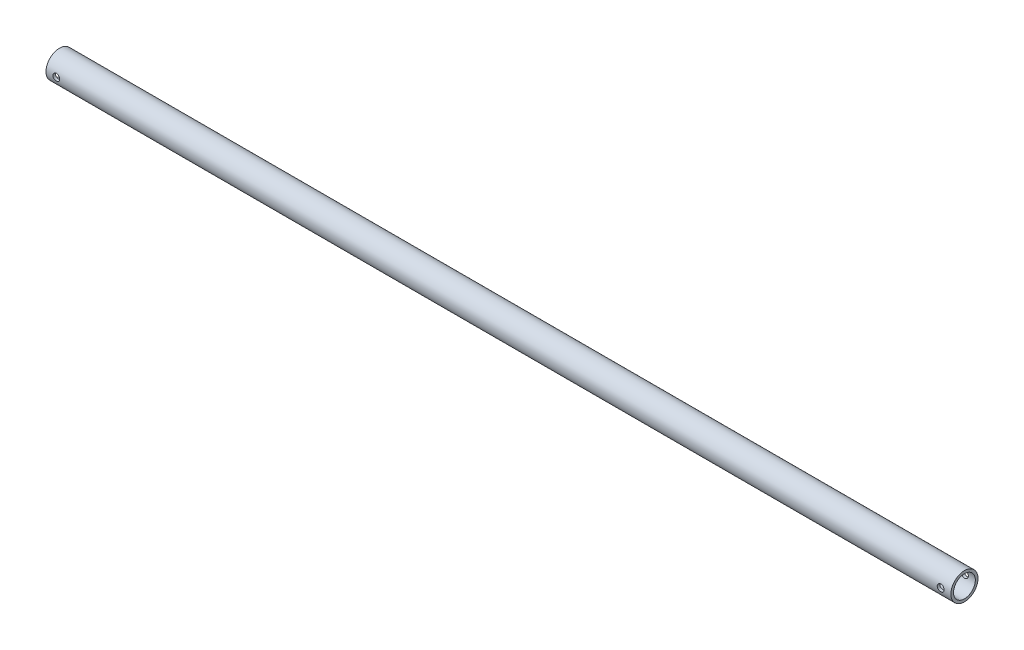
from build123d import *

# Parameters (mm, degrees)
SKETCH1_R               = 6.35
SKETCH1_R_2             = 5.1054
BOSS_EXTRUDE1_DEPTH     = 424.12412
CUT_EXTRUDE1_DEPTH      = 425.219181751
CUT_EXTRUDE1_DEPTH_BACK = 425.219181751
SKETCH2_R               = 1.5875


with BuildPart() as part:
    # Sketch1 → Boss-Extrude1 (new body)
    with BuildSketch(Plane(origin=(0, 0, 0), x_dir=(0, 0, -1), z_dir=(1, 0, 0))):
        Circle(SKETCH1_R)
        Circle(SKETCH1_R_2, mode=Mode.SUBTRACT)
    extrude(amount=BOSS_EXTRUDE1_DEPTH)

    # Sketch2 → Cut-Extrude1 (cut, two sides: drawn at the far end of the back side and taken through both)
    with BuildSketch(Plane.XY.offset(-CUT_EXTRUDE1_DEPTH_BACK)):
        with Locations((4.826, 0)):
            Circle(SKETCH2_R)
        with Locations((419.29812, 0)):
            Circle(SKETCH2_R)
    extrude(amount=CUT_EXTRUDE1_DEPTH + CUT_EXTRUDE1_DEPTH_BACK, mode=Mode.SUBTRACT)


solid = part.part
